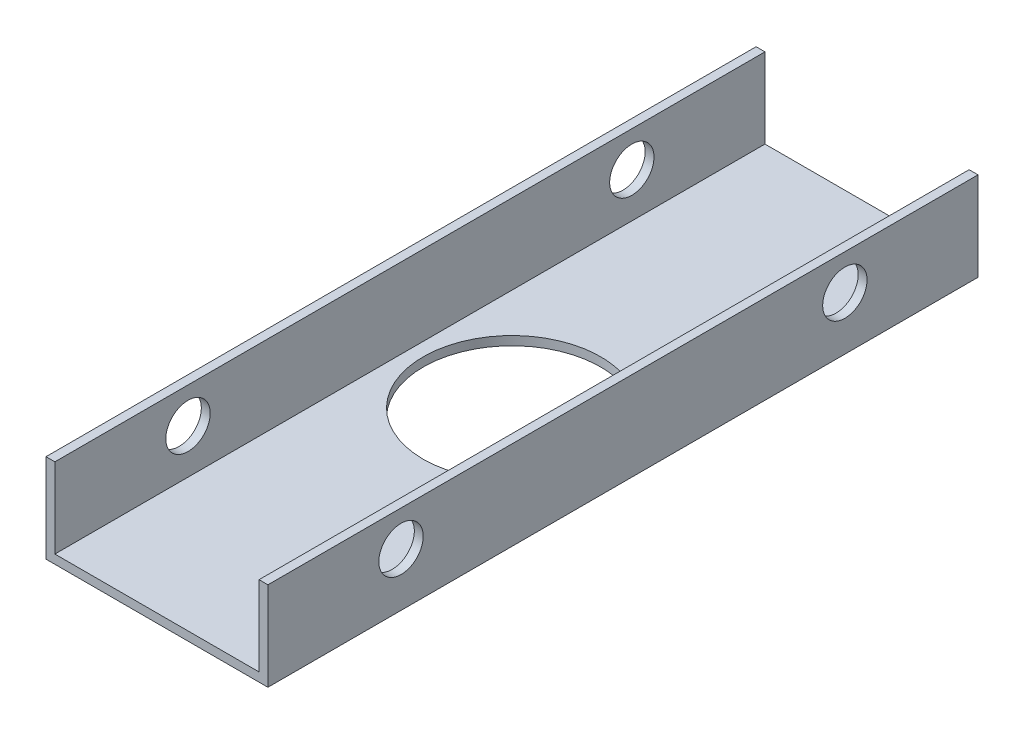
from build123d import *

# Parameters (mm, degrees)
SKETCH2_W           = 23
SKETCH2_H           = 80
SKETCH2_R           = 10
BOSS_EXTRUDE1_DEPTH = 1
SKETCH3_W           = 80
SKETCH3_H           = 10
SKETCH3_R           = 2.5
BOSS_EXTRUDE2_DEPTH = 1


with BuildPart() as part:
    # Sketch2 → Boss-Extrude1 (new body)
    with BuildSketch(Plane(origin=(0, 0, 0), x_dir=(1, 0, 0), z_dir=(0, 1, 0))):
        Rectangle(SKETCH2_W, SKETCH2_H)
        with Locations(Location((0, 0, 0), (0, 0, 270))):
            Circle(SKETCH2_R, mode=Mode.SUBTRACT)
    extrude(amount=BOSS_EXTRUDE1_DEPTH)

    # Sketch3 → Boss-Extrude2 (add)
    with BuildSketch(Plane.ZY.offset(11.5)):
        with Locations((0, 5)):
            Rectangle(SKETCH3_W, SKETCH3_H)
        with Locations((-25, 6)):
            Circle(SKETCH3_R, mode=Mode.SUBTRACT)
        with Locations(Location((25, 6, 0), (0, 0, 180))):
            Circle(SKETCH3_R, mode=Mode.SUBTRACT)
    boss_extrude2 = extrude(amount=BOSS_EXTRUDE2_DEPTH)

    # Mirror1: Boss-Extrude2 across plane
    add(boss_extrude2.mirror(Plane(origin=(0, 0, 0), x_dir=(0, 0, 1), z_dir=(1, 0, 0))))


solid = part.part
